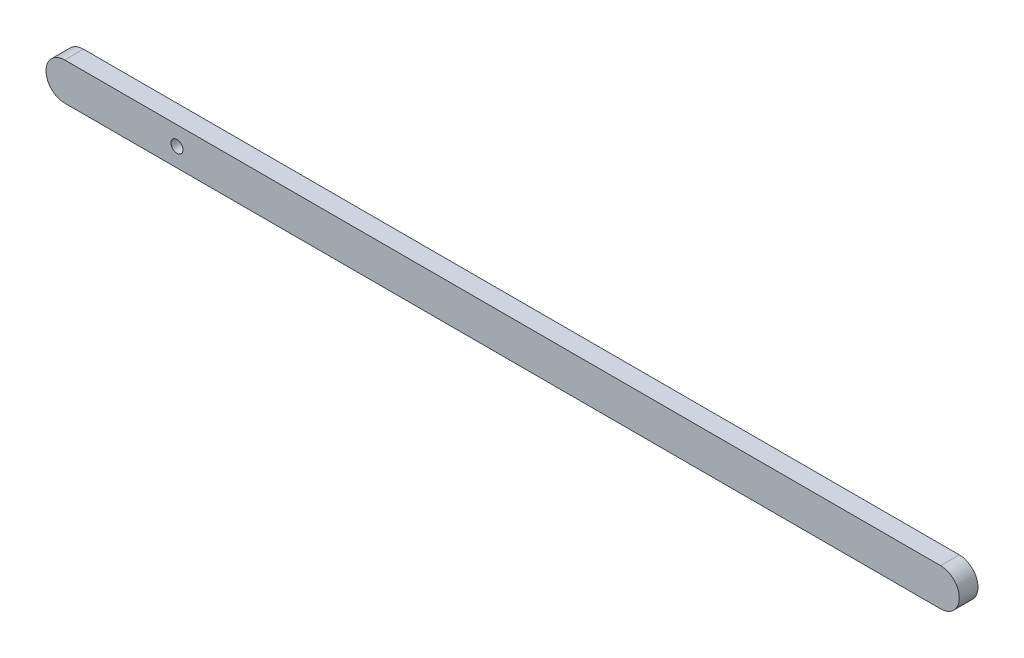
from build123d import *

# Parameters (mm, degrees)
SKETCH_1_R      = 1.6
EXTRUDE_1_DEPTH = 5


with BuildPart() as part:
    # 草图1 → 凸台-拉伸1 (new body)
    with BuildSketch(Plane.XY):
        with BuildLine():
            Line((0, 5), (234, 5))
            ThreePointArc((234, 5), (239, 0), (234, -5))
            Line((234, -5), (0, -5))
            ThreePointArc((0, -5), (-5, 0), (0, 5))
        make_face()
        with Locations((30, 0)):
            Circle(SKETCH_1_R, mode=Mode.SUBTRACT)
    extrude(amount=EXTRUDE_1_DEPTH)


solid = part.part
